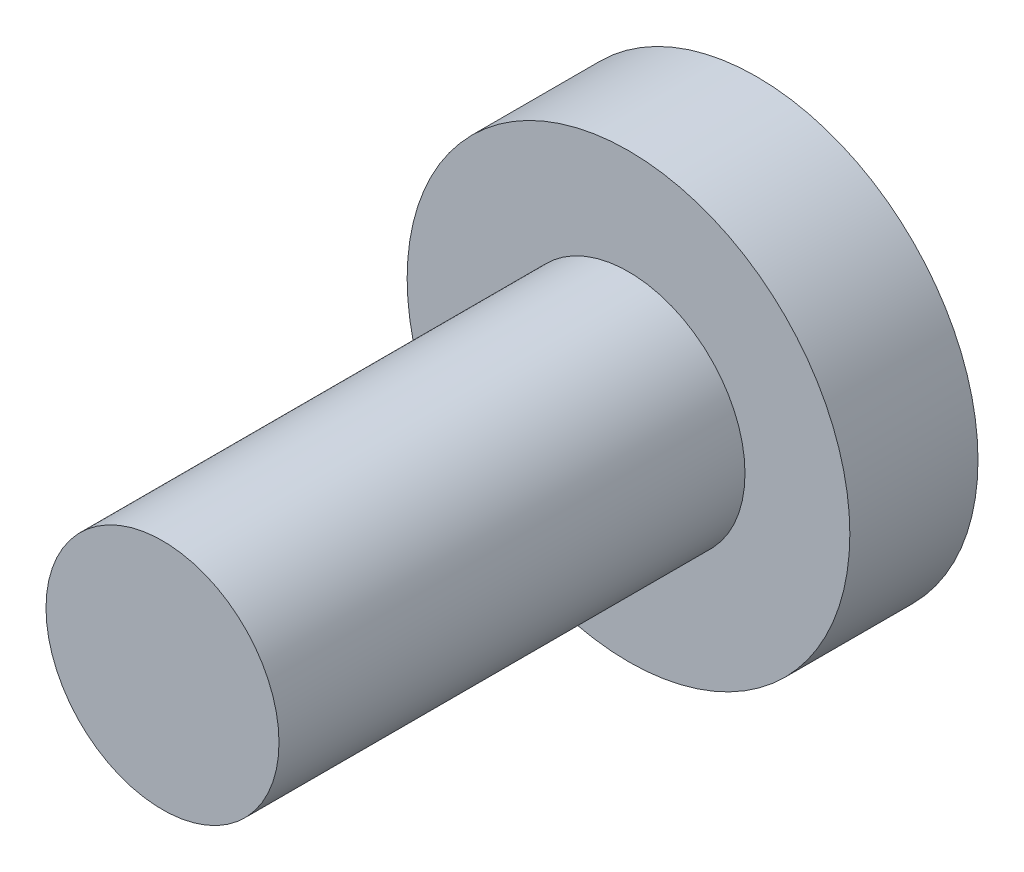
from build123d import *

# Parameters (mm, degrees)
F_01_START                                     = -1.65
S01_ISO_7380_BUTTON_HEAD_CLEARANCE_ENV_R       = 2.85
F_01_ISO_7380_BUTTON_HEAD_CLEARANCE_ENVE_DEPTH = 1.65
S02_M3_UNDERHEAD_LENGTH_R                      = 1.5
F_02_M3_UNDERHEAD_LENGTH_DEPTH                 = 6
F_03_START                                     = -1.75
F_03_BUTTON_HEAD_HEX_SOCKET_DEPTH              = 1.12


with BuildPart() as part:
    # S01 - ISO 7380 button head clearance envelope → 01 - ISO 7380 button head clearance envelope (new body)
    with BuildSketch(Plane.XY.offset(F_01_START)):
        Circle(S01_ISO_7380_BUTTON_HEAD_CLEARANCE_ENV_R)
    extrude(amount=F_01_ISO_7380_BUTTON_HEAD_CLEARANCE_ENVE_DEPTH)

    # S02 - M3 underhead length → 02 - M3 underhead length (add)
    with BuildSketch(Plane.XY):
        Circle(S02_M3_UNDERHEAD_LENGTH_R)
    extrude(amount=F_02_M3_UNDERHEAD_LENGTH_DEPTH)

    # S03 - Button head hex socket → 03 - Button head hex socket (cut)
    with BuildSketch(Plane.XY.offset(F_03_START)):
        Polygon((1.154700538, 0), (0.577350269, 1), (-0.577350269, 1), (-1.154700538, 0), (-0.577350269, -1), (0.577350269, -1), align=None)
    extrude(amount=F_03_BUTTON_HEAD_HEX_SOCKET_DEPTH, mode=Mode.SUBTRACT)


solid = part.part
